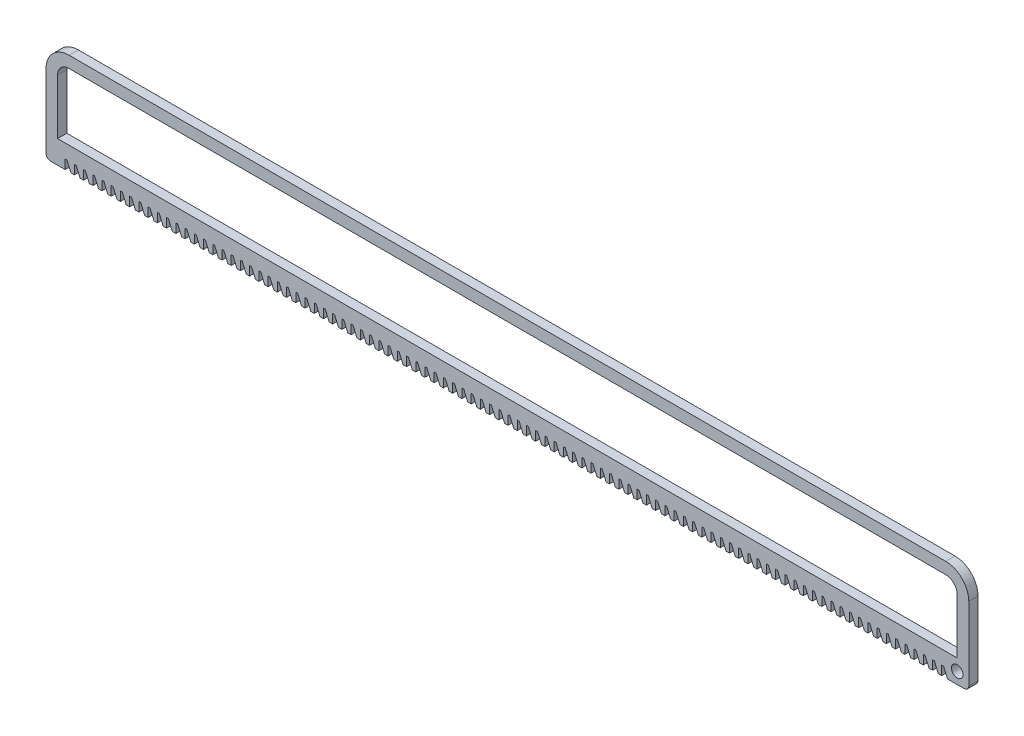
from build123d import *

# Parameters (mm, degrees)
SKETCH1_W           = 400
SKETCH1_H           = 10
BOSS_EXTRUDE1_DEPTH = 4
BOSS_EXTRUDE2_DEPTH = 4
CUT_EXTRUDE13_DEPTH = 204.766943352
LPATTERN2_COUNT     = 84
LPATTERN2_PITCH     = 4
LPATTERN2_COL_COUNT = 13
LPATTERN2_COL_PITCH = 4
SKETCH5_R           = 2.5
CUT_EXTRUDE14_DEPTH = 204.766943352
FILLET7_R           = 2


with BuildPart() as part:
    # Sketch1 → Boss-Extrude1 (new body)
    with BuildSketch(Plane.XY):
        Rectangle(SKETCH1_W, SKETCH1_H)
    extrude(amount=BOSS_EXTRUDE1_DEPTH)

    # Sketch2 → Boss-Extrude2 (add)
    with BuildSketch(Plane.XY):
        with BuildLine():
            Line((-200, 5), (-200, 28.793906777))
            ThreePointArc((-200, 28.793906777), (-197.071067812, 35.864974589), (-190, 38.793906777))
            Line((-190, 38.793906777), (190, 38.793906777))
            ThreePointArc((190, 38.793906777), (197.071067812, 35.864974589), (200, 28.793906777))
            Line((200, 28.793906777), (200, 5))
            Line((200, 5), (195, 5))
            Line((195, 5), (195, 28.793906777))
            ThreePointArc((195, 28.793906777), (193.535533906, 32.329440683), (190, 33.793906777))
            Line((190, 33.793906777), (-190, 33.793906777))
            ThreePointArc((-190, 33.793906777), (-193.535533906, 32.329440683), (-195, 28.793906777))
            Line((-195, 28.793906777), (-195, 5))
            Line((-195, 5), (-200, 5))
        make_face()
    extrude(amount=BOSS_EXTRUDE2_DEPTH)

    # Sketch4 → Cut-Extrude13 (cut, through all)
    with BuildSketch(Plane.XY.offset(4)):
        Polygon((-142.917614392, -1), (-143.717614392, -1), (-143.717614392, -5), (-141.217614392, -5), align=None)
    cut_extrude13 = extrude(amount=-CUT_EXTRUDE13_DEPTH, mode=Mode.SUBTRACT)

    # LPattern2: Cut-Extrude13 ×84
    with Locations(*[(i * LPATTERN2_PITCH, 0, 0) for i in range(1, LPATTERN2_COUNT)]):
        add(cut_extrude13, mode=Mode.SUBTRACT)

    # LPattern2 col: Cut-Extrude13 ×13
    with Locations(*[(-i * LPATTERN2_COL_PITCH, 0, 0) for i in range(1, LPATTERN2_COL_COUNT)]):
        add(cut_extrude13, mode=Mode.SUBTRACT)

    # Sketch5 → Cut-Extrude14 (cut, through all)
    with BuildSketch(Plane.XY.offset(4)):
        with Locations((195, 0)):
            Circle(SKETCH5_R)
    extrude(amount=-CUT_EXTRUDE14_DEPTH, mode=Mode.SUBTRACT)

    # Fillet7
    fillet7_edges = [part.edges().sort_by_distance(p)[0] for p in [
        (200, -5, 2),
        (-200, -5, 2),
    ]]
    fillet(fillet7_edges, radius=FILLET7_R)


solid = part.part
